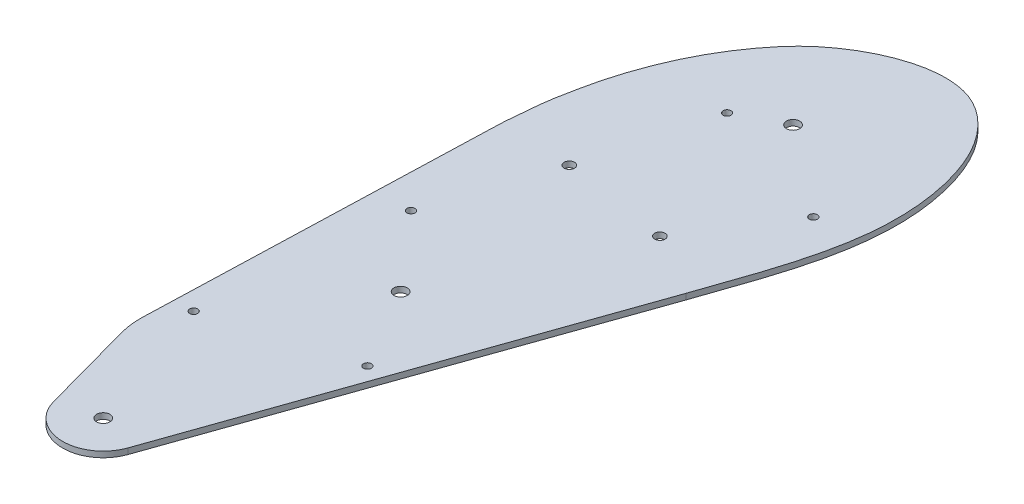
from build123d import *

# Parameters (mm, degrees)
SKETCH1_R           = 2.455
SKETCH1_R_2         = 1.475
SKETCH1_R_3         = 1.925
BOSS_EXTRUDE1_DEPTH = 2.15


with BuildPart() as part:
    # Sketch1 → Boss-Extrude1 (new body)
    with BuildSketch(Plane(origin=(0, 0, 0), x_dir=(1, 0, 0), z_dir=(0, 1, 0))):
        with BuildLine():
            Line((-82.919787444, -128.698908445), (-29.140629004, 24.317395253))
            add(Edge.make_bspline(
                [(-29.140629004, 24.317395253), (-23.337858539, 41.277059327), (-12.859922069, 68.46207501), (-14.319919643, 106.433004768), (-23.539271508, 129.054084446), (-49.289871518, 148.405248856), (-78.031844676, 135.576474168), (-101.152133843, 109.291651208), (-108.95092469, 92.729531905), (-113.164975056, 76.676804997)],
                knots=[0.130450955, 0.130450955, 0.130450955, 0.130450955, 0.339996476, 0.443939453, 0.557712873, 0.600920567, 0.79656388, 0.817312416, 1, 1, 1, 1], degree=3))
            add(Edge.make_bspline(
                [(-113.164975056, 76.676804997), (-114.293306759, 72.049304665), (-115.240161991, 67.388956151), (-116.086927837, 62.766035919)],
                knots=[0.01328584, 0.01328584, 0.01328584, 0.01328584, 0.075217512, 0.075217512, 0.075217512, 0.075217512], degree=3))
            add(Edge.make_bspline(
                [(-116.086927837, 62.766035919), (-116.348548805, 61.136035297), (-116.584476112, 59.498418841), (-116.795112166, 57.854481822)],
                knots=[0.060715751, 0.060715751, 0.060715751, 0.060715751, 0.078641805, 0.078641805, 0.078641805, 0.078641805], degree=3))
            Line((-116.795112166, 57.854481822), (-117.884405612, 45.850341496))
            add(Edge.make_bspline(
                [(-117.884405612, 45.850341496), (-117.972649156, 44.230573242), (-118.037929563, 42.60779089), (-118.080616055, 40.983182889)],
                knots=[0, 0, 0, 0, 0.017419058, 0.017419058, 0.017419058, 0.017419058], degree=3))
            Line((-118.080616055, 40.983182889), (-122.147838246, -84.01073193))
            ThreePointArc((-122.147838246, -84.01073193), (-121.955556235, -88.514252193), (-121.090684612, -92.938126535))
            Line((-121.090684612, -92.938126535), (-111.534695628, -127.701111051))
            ThreePointArc((-111.534695628, -127.701111051), (-97.593937187, -138.716134992), (-82.919787444, -128.698908445))
        make_face()
        with Locations(Location((-97.07120722, -123.72524598, 0), (0, 0, 90))):
            Circle(SKETCH1_R, mode=Mode.SUBTRACT)
        with Locations(Location((-114.601772791, -72.657901757, 0), (0, 0, 90))):
            Circle(SKETCH1_R_2, mode=Mode.SUBTRACT)
        with Locations(Location((-64.843187058, -58.043882944, 0), (0, 0, 90))):
            Circle(SKETCH1_R_2, mode=Mode.SUBTRACT)
        with Locations(Location((-82.539469357, -28.04652318, 0), (0, 0, 90))):
            Circle(SKETCH1_R, mode=Mode.SUBTRACT)
        with Locations(Location((-106.618198832, -0.114198055, 0), (0, 0, 90))):
            Circle(SKETCH1_R_2, mode=Mode.SUBTRACT)
        with Locations(Location((-52.307689331, 37.810609892, 0), (0, 0, 90))):
            Circle(SKETCH1_R_3, mode=Mode.SUBTRACT)
        with Locations(Location((-91.854166633, 43.816950954, 0), (0, 0, 90))):
            Circle(SKETCH1_R_3, mode=Mode.SUBTRACT)
        with Locations(Location((-30.041231326, 72.427446852, 0), (0, 0, 90))):
            Circle(SKETCH1_R_2, mode=Mode.SUBTRACT)
        with Locations(Location((-79.40873095, 89.814244628, 0), (0, 0, 90))):
            Circle(SKETCH1_R_2, mode=Mode.SUBTRACT)
        with Locations(Location((-63.361132615, 98.225969641, 0), (0, 0, 90))):
            Circle(SKETCH1_R, mode=Mode.SUBTRACT)
    extrude(amount=BOSS_EXTRUDE1_DEPTH)


solid = part.part
